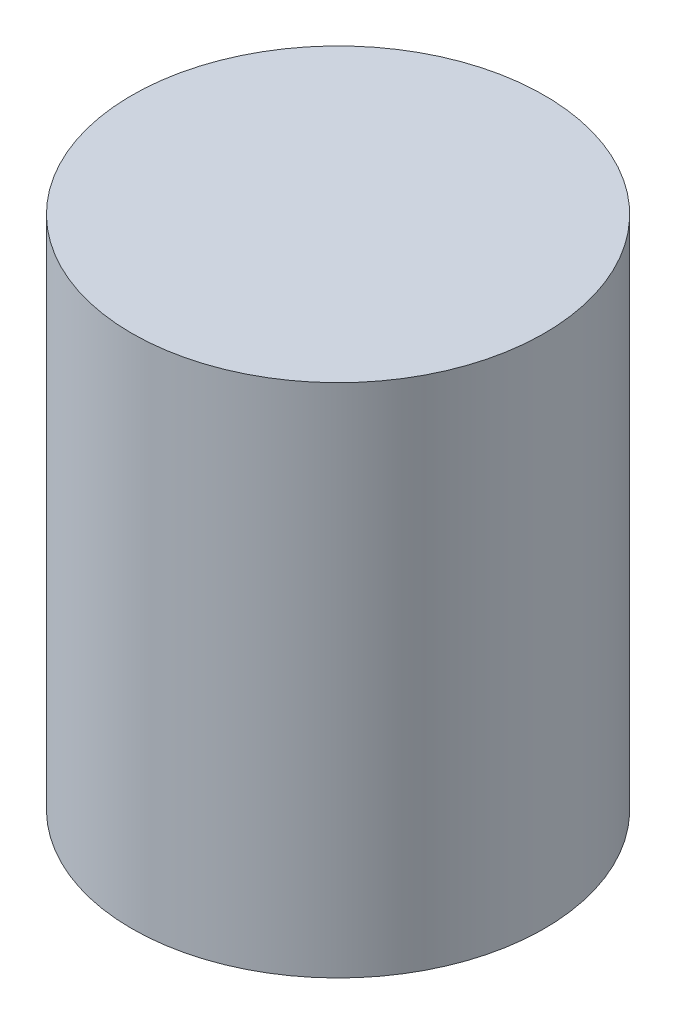
from build123d import *

# Parameters (mm, degrees)
SKETCH1_R           = 20
BOSS_EXTRUDE1_DEPTH = 50


with BuildPart() as part:
    # Sketch1 → Boss-Extrude1 (new body)
    with BuildSketch(Plane(origin=(0, 0, 0), x_dir=(1, 0, 0), z_dir=(0, 1, 0))):
        with Locations(Location((0, 0, 0), (0, 0, 270))):
            Circle(SKETCH1_R)
    extrude(amount=BOSS_EXTRUDE1_DEPTH)


solid = part.part
